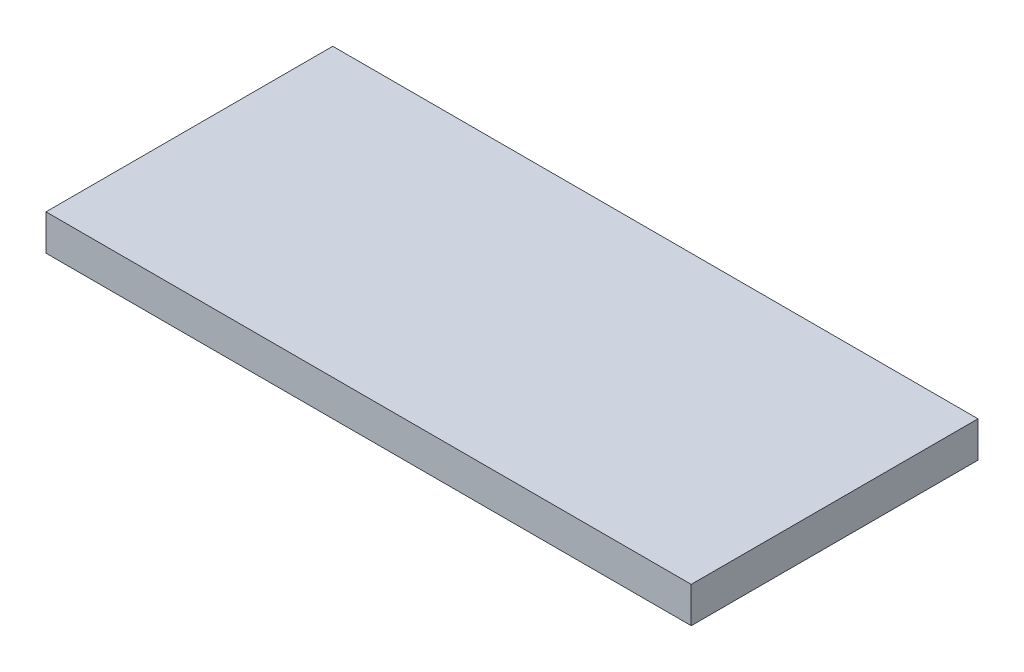
from build123d import *

# Parameters (mm, degrees)
SKETCH_1_W            = 900
SKETCH_1_H            = 400
EXTRUDE_900X300_DEPTH = 50


with BuildPart() as part:
    # 스케치1 → 900x300 (new body)
    with BuildSketch(Plane(origin=(0, 0, 0), x_dir=(1, 0, 0), z_dir=(0, 1, 0))):
        Rectangle(SKETCH_1_W, SKETCH_1_H)
    extrude(amount=EXTRUDE_900X300_DEPTH)


solid = part.part
